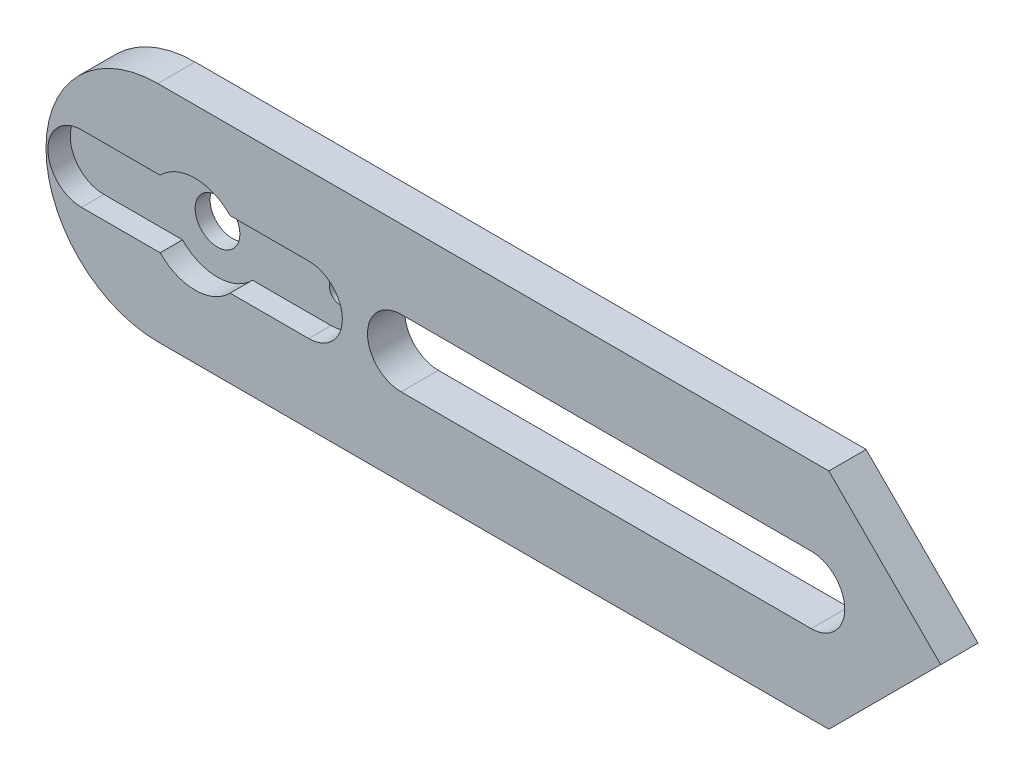
from build123d import *

# Parameters (mm, degrees)
BOSS_EXTRUDE1_DEPTH = 5
SKETCH2_R           = 3
SKETCH2_R_2         = 1.5
CUT_EXTRUDE1_DEPTH  = 5
SKETCH3_R           = 6.5
CUT_EXTRUDE2_DEPTH  = 3
CUT_EXTRUDE3_DEPTH  = 3
CUT_EXTRUDE4_DEPTH  = 5


with BuildPart() as part:
    # Sketch1 → Boss-Extrude1 (new body)
    with BuildSketch(Plane.XY):
        with BuildLine():
            Line((40, -15), (55, 0))
            Line((55, 0), (40, 15))
            Line((40, 15), (-50, 15))
            ThreePointArc((-50, 15), (-65, 0), (-50, -15))
            Line((-50, -15), (40, -15))
        make_face()
    extrude(amount=BOSS_EXTRUDE1_DEPTH)

    # Sketch2 → Cut-Extrude1 (cut)
    with BuildSketch(Plane.XY.offset(5)):
        with Locations((-45, 0)):
            Circle(SKETCH2_R)
        with Locations((-28.5, 0)):
            Circle(SKETCH2_R_2)
    extrude(amount=-CUT_EXTRUDE1_DEPTH, mode=Mode.SUBTRACT)

    # Sketch3 → Cut-Extrude2 (cut)
    with BuildSketch(Plane.XY.offset(5)):
        with Locations((-45, 0)):
            Circle(SKETCH3_R)
    extrude(amount=-CUT_EXTRUDE2_DEPTH, mode=Mode.SUBTRACT)

    # Sketch4 → Cut-Extrude3 (cut)
    with BuildSketch(Plane.XY.offset(5)):
        with BuildLine():
            Line((-29.755535663, -4.5), (-60.244464337, -4.5))
            ThreePointArc((-60.244464337, -4.5), (-64.744464337, 0), (-60.244464337, 4.5))
            Line((-60.244464337, 4.5), (-29.755535663, 4.5))
            ThreePointArc((-29.755535663, 4.5), (-25.255535663, 0), (-29.755535663, -4.5))
        make_face()
    extrude(amount=-CUT_EXTRUDE3_DEPTH, mode=Mode.SUBTRACT)

    # Sketch6 → Cut-Extrude4 (cut)
    with BuildSketch(Plane.XY.offset(5)):
        with BuildLine():
            Line((-17.3786019, 4.5), (37.6213981, 4.5))
            ThreePointArc((37.6213981, 4.5), (42.1213981, 0), (37.6213981, -4.5))
            Line((37.6213981, -4.5), (-17.3786019, -4.5))
            ThreePointArc((-17.3786019, -4.5), (-21.8786019, 0), (-17.3786019, 4.5))
        make_face()
    extrude(amount=-CUT_EXTRUDE4_DEPTH, mode=Mode.SUBTRACT)


solid = part.part
